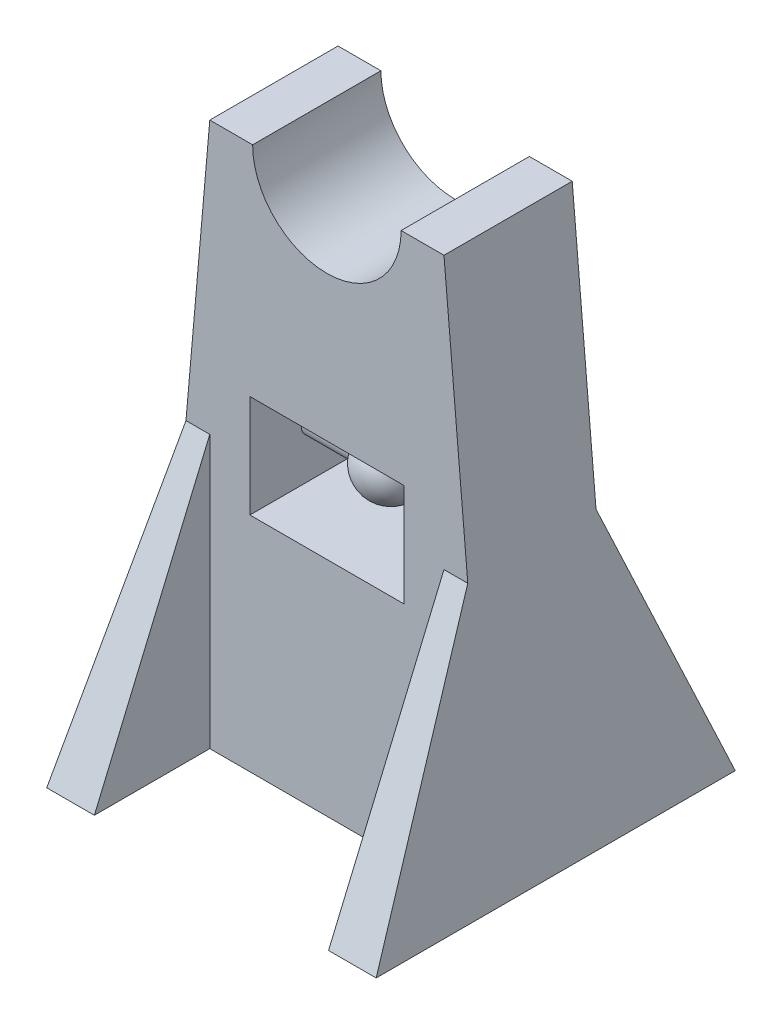
from build123d import *

# Parameters (mm, degrees)
BOSS_EXTRUDE1_DEPTH      = 25
BOSS_EXTRUDE1_DEPTH_BACK = 25
SKETCH2_W                = 60
SKETCH2_H                = 40
BOSS_EXTRUDE7_REACH      = 242.299
BOSS_EXTRUDE8_REACH      = 251.036
SWEEP3_PROFILE_R         = 5


with BuildPart() as part:
    # Sketch2 → Boss-Extrude1 (new, two sides: drawn at the far end of the back side and taken through both)
    with BuildSketch(Plane.XY.offset(-BOSS_EXTRUDE1_DEPTH_BACK)):
        with BuildLine():
            Line((-28.9435, 0), (-45.651634272, 0))
            Line((-45.651634272, 0), (-64.220455689, -212.2426))
            Line((-64.220455689, -212.2426), (64.220455689, -212.2426))
            Line((64.220455689, -212.2426), (45.651634272, 0))
            Line((45.651634272, 0), (28.9435, 0))
            ThreePointArc((28.9435, 0), (0, -28.9435), (-28.9435, 0))
        make_face()
        with Locations((0, -105.527024802)):
            Rectangle(SKETCH2_W, SKETCH2_H, mode=Mode.SUBTRACT)
    extrude(amount=BOSS_EXTRUDE1_DEPTH + BOSS_EXTRUDE1_DEPTH_BACK)

    # Boss-Extrude7: up to this plane
    boss_extrude7_end = Plane(origin=(-45.651634272, 0, -25), z_dir=(-0.9961946980917452, 0.08715574274766147, 0))
    # Sketch58 → Boss-Extrude7 (add, up to the surface)
    with BuildSketch(Plane(origin=(-45.651634272, 0, 0), x_dir=(0, 0, -1), z_dir=(1, 0, 0)), mode=Mode.PRIVATE) as boss_extrude7_sk1:
        Polygon((25, -106.1213), (25, -212.2426), (70, -212.2426), align=None)
    boss_extrude7_tool1 = split(extrude(boss_extrude7_sk1.sketch, amount=-BOSS_EXTRUDE7_REACH, mode=Mode.PRIVATE), bisect_by=boss_extrude7_end, keep=Keep.BOTH, mode=Mode.PRIVATE)
    add(boss_extrude7_tool1.solids().sort_by_distance((-45.651634, -176.868833, -40))[0])
    # Sketch58 → Boss-Extrude7 (add, up to the surface)
    with BuildSketch(Plane(origin=(-45.651634272, 0, 0), x_dir=(0, 0, -1), z_dir=(1, 0, 0)), mode=Mode.PRIVATE) as boss_extrude7_sk2:
        Polygon((-25, -212.2426), (-70, -212.2426), (-25, -106.1213), align=None)
    boss_extrude7_tool2 = split(extrude(boss_extrude7_sk2.sketch, amount=-BOSS_EXTRUDE7_REACH, mode=Mode.PRIVATE), bisect_by=boss_extrude7_end, keep=Keep.BOTH, mode=Mode.PRIVATE)
    add(boss_extrude7_tool2.solids().sort_by_distance((-45.651634, -176.868833, 40))[0])

    # Boss-Extrude8: up to this plane
    boss_extrude8_end = Plane(origin=(45.651634272, 0, -25), z_dir=(0.9961946980917452, 0.08715574274766147, 0))
    # Sketch59 → Boss-Extrude8 (add, up to the surface)
    with BuildSketch(Plane(origin=(45.651634272, 0, 0), x_dir=(0, 0, -1), z_dir=(1, 0, 0)), mode=Mode.PRIVATE) as boss_extrude8_sk1:
        Polygon((25, -106.1213), (25, -212.2426), (70, -212.2426), align=None)
    boss_extrude8_tool1 = split(extrude(boss_extrude8_sk1.sketch, amount=BOSS_EXTRUDE8_REACH, mode=Mode.PRIVATE), bisect_by=boss_extrude8_end, keep=Keep.BOTH, mode=Mode.PRIVATE)
    add(boss_extrude8_tool1.solids().sort_by_distance((45.651634, -176.868833, -40))[0])
    # Sketch59 → Boss-Extrude8 (add, up to the surface)
    with BuildSketch(Plane(origin=(45.651634272, 0, 0), x_dir=(0, 0, -1), z_dir=(1, 0, 0)), mode=Mode.PRIVATE) as boss_extrude8_sk2:
        Polygon((-25, -212.2426), (-70, -212.2426), (-25, -106.1213), align=None)
    boss_extrude8_tool2 = split(extrude(boss_extrude8_sk2.sketch, amount=BOSS_EXTRUDE8_REACH, mode=Mode.PRIVATE), bisect_by=boss_extrude8_end, keep=Keep.BOTH, mode=Mode.PRIVATE)
    add(boss_extrude8_tool2.solids().sort_by_distance((45.651634, -176.868833, 40))[0])



with BuildPart() as body_2:
    # Sketch60 → Revolve9 (revolve)
    with BuildSketch(Plane.XY):
        with BuildLine():
            Line((0, -117.527024802), (0, -93.527024802))
            ThreePointArc((0, -93.527024802), (-12, -105.527024802), (0, -117.527024802))
        make_face()
    revolve(axis=Axis((0, 0, 0), (0, -1, 0)))


with BuildPart() as part_1:
    add(part.part)

    add(body_2.part)  # Sweep3 merges body 2
    # Sweep3: sweep along a path in Sketch62
    with BuildLine(Plane.XY) as sweep3_path:
        Line((30, -105.527024802), (-30, -105.527024802))
    # Sweep3 profile (on start of the path) → Sweep3 (sweep)
    with BuildSketch(Plane(origin=(30, -105.527024802, 0), x_dir=(0, 0, -1), z_dir=(-1, 0, 0))):
        Circle(SWEEP3_PROFILE_R)
    sweep(path=sweep3_path.line)


solid = part_1.part
